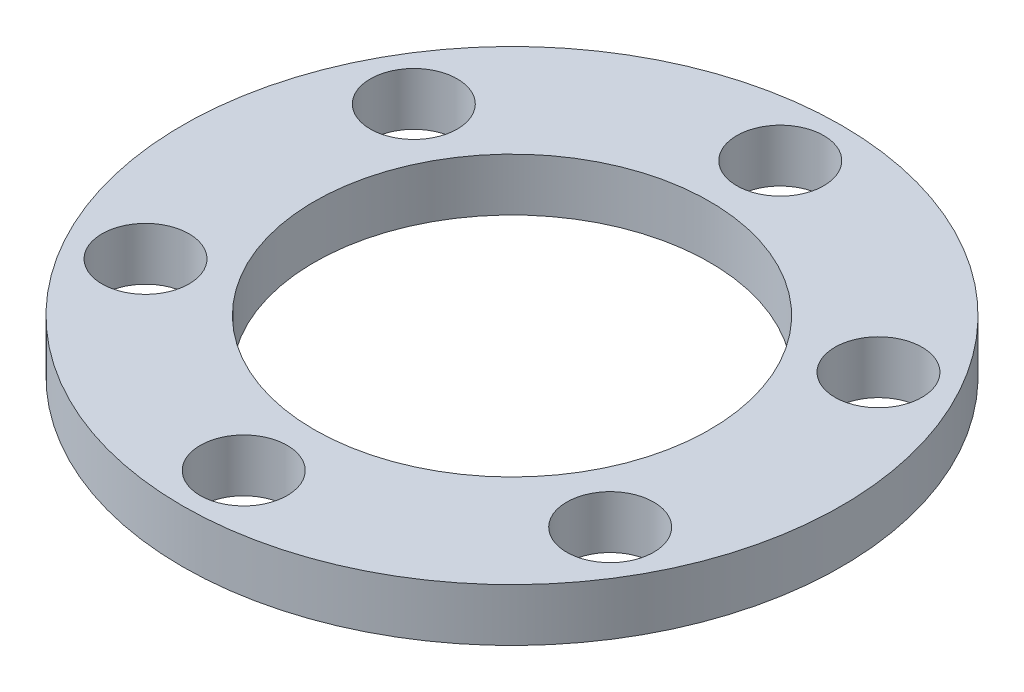
from build123d import *

# Parameters (mm, degrees)
SKETCH_1_R               = 12.5
EXTRUDE_1_DEPTH          = 2
SKETCH_2_R               = 1.65
CUT_EXTRUDE_1_DEPTH      = 18.790446875
PATTERN_CIRCULAR_1_COUNT = 6
SKETCH_6_R               = 7.5
CUT_EXTRUDE_3_DEPTH      = 18.790446875


with BuildPart() as part:
    # Эскиз1 → Бобышка-Вытянуть1 (new body)
    with BuildSketch(Plane(origin=(0, 0, 0), x_dir=(1, 0, 0), z_dir=(0, 1, 0))):
        with Locations(Location((0, 0, 0), (0, 0, 270))):
            Circle(SKETCH_1_R)
    extrude(amount=EXTRUDE_1_DEPTH)

    # Эскиз2 → Вырез-Вытянуть1 (cut, through all)
    with BuildSketch(Plane.XZ):
        with Locations(Location((0, -10.176132167, 0), (0, 0, 270))):
            Circle(SKETCH_2_R)
    cut_extrude_1 = extrude(amount=-CUT_EXTRUDE_1_DEPTH, mode=Mode.SUBTRACT)

    # Круговой массив1: Вырез-Вытянуть1 ×6 about axis
    pattern_circular_1_axis = Axis((0, 0, 0), (0, 1, 0))
    for i in range(1, PATTERN_CIRCULAR_1_COUNT):
        add(cut_extrude_1.rotate(pattern_circular_1_axis, i * 360 / PATTERN_CIRCULAR_1_COUNT), mode=Mode.SUBTRACT)

    # Эскиз6 → Вырез-Вытянуть3 (cut, through all)
    with BuildSketch(Plane(origin=(0, 2, 0), x_dir=(1, 0, 0), z_dir=(0, 1, 0))):
        with Locations(Location((0, 0, 0), (0, 0, 270))):
            Circle(SKETCH_6_R)
    extrude(amount=-CUT_EXTRUDE_3_DEPTH, mode=Mode.SUBTRACT)


solid = part.part
